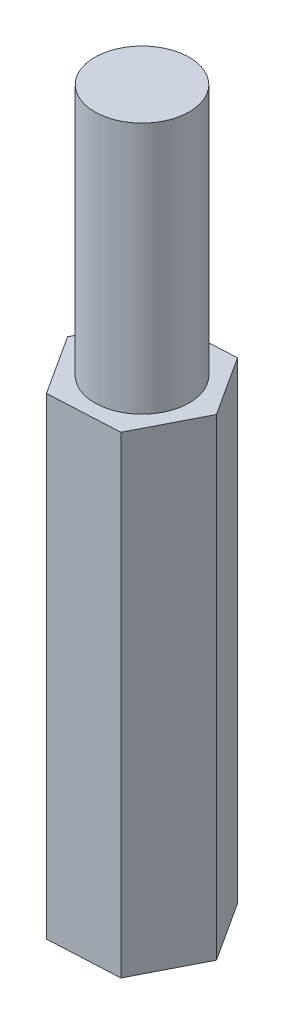
from build123d import *

# Parameters (mm, degrees)
EXTRUDE_1_DEPTH = 15
SKETCH_2_R      = 1.5
EXTRUDE_2_DEPTH = 8


with BuildPart() as part:
    # 草图1 → 凸台-拉伸1 (new body)
    with BuildSketch(Plane(origin=(0, 0, 0), x_dir=(1, 0, 0), z_dir=(0, 1, 0))):
        Polygon((1.223286927, -1.891811175), (2.25, 0.113491968), (1.026713073, 2.005303142), (-1.223286927, 1.891811175), (-2.25, -0.113491968), (-1.026713073, -2.005303142), align=None)
    extrude(amount=EXTRUDE_1_DEPTH)

    # 草图2 → 凸台-拉伸2 (add)
    with BuildSketch(Plane(origin=(0, 15, 0), x_dir=(1, 0, 0), z_dir=(0, 1, 0))):
        with Locations(Location((0, 0, 0), (0, 0, 270))):
            Circle(SKETCH_2_R)
    extrude(amount=EXTRUDE_2_DEPTH)


solid = part.part
